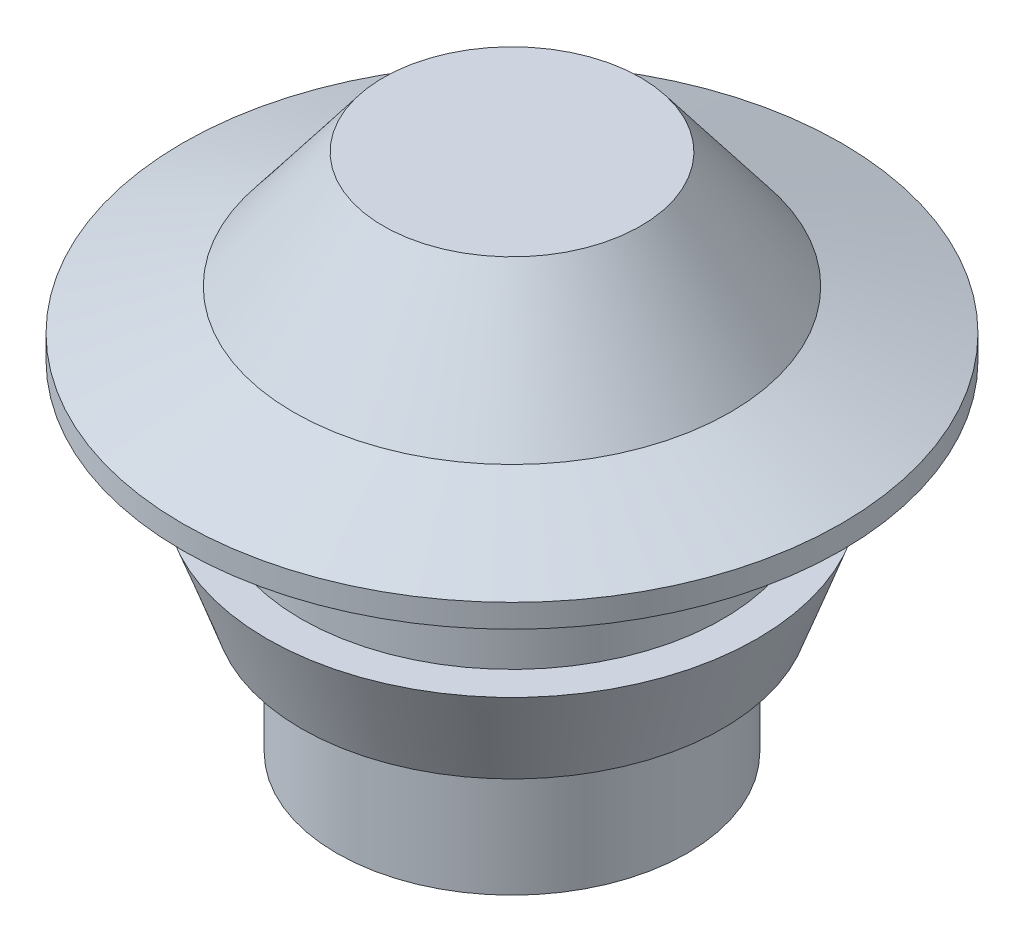
from build123d import *

# Parameters (mm, degrees)
CUT_EXTRUDE_1_DEPTH      = 30.98083763
CUT_EXTRUDE_1_DEPTH_BACK = 9.075
SKETCH_2_R               = 5.6


with BuildPart() as part:
    # Эскиз1 → Повернуть1 (revolve)
    with BuildSketch(Plane.XY, mode=Mode.PRIVATE) as revolve_1_sk:
        Polygon((0, 0), (-7.525, 0), (-7.525, 5.4), (-9.05, 5.4), (-10.525, 9.475), (-9.05, 9.475), (-9.05, 14.575), (-14.15, 14.575), (-14.15, 15.575), (-9.375, 17.325), (-5.525, 22.325), (0, 22.325), align=None)
    revolve(revolve_1_sk.sketch.rotate(Axis((0, 0, 0), (0, 1, 0)), 270), axis=Axis((0, 0, 0), (0, 1, 0)))

    # Эскиз2 → Вырез-Вытянуть1 (cut, two sides: drawn at the far end of the back side and taken through both)
    with BuildSketch(Plane.XZ.offset(-CUT_EXTRUDE_1_DEPTH_BACK)):
        with Locations(Location((0, 0, 0), (0, 0, 90))):
            Circle(SKETCH_2_R)
    extrude(amount=CUT_EXTRUDE_1_DEPTH + CUT_EXTRUDE_1_DEPTH_BACK, mode=Mode.SUBTRACT)


solid = part.part
